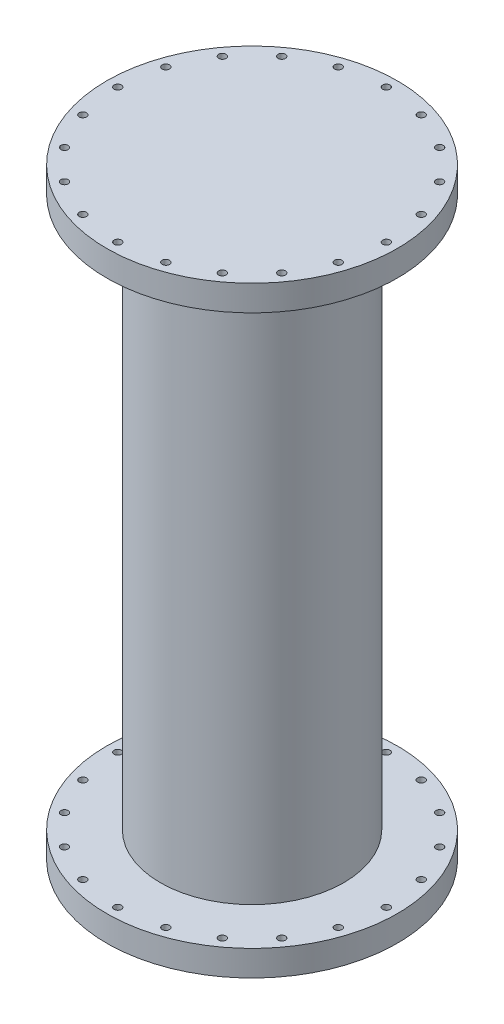
from build123d import *

# Parameters (mm, degrees)
ESQUISSE2_R                  = 10
ENL_V_MAT_EXTRU_1_DEPTH      = 1733.983554452
R_P_TITION_CIRCULAIRE1_COUNT = 20


with BuildPart() as part:
    # Esquisse1 → Révolution1 (revolve)
    with BuildSketch(Plane.XY, mode=Mode.PRIVATE) as r_volution1_sk:
        Polygon((0, 0), (396, 0), (396, -70), (250, -70), (250, -1570), (396, -1570), (396, -1640), (0, -1640), (0, -1570), (200, -1570), (200, -70), (0, -70), align=None)
    revolve(r_volution1_sk.sketch.rotate(Axis((0, 0, 0), (0, -1, 0)), 180), axis=Axis((0, 0, 0), (0, -1, 0)))

    # Esquisse2 → Enlèv. mat.-Extru.1 (cut, through all)
    with BuildSketch(Plane(origin=(0, 0, 0), x_dir=(1, 0, 0), z_dir=(0, 1, 0))):
        with Locations(Location((366, 0, 0), (0, 0, 180))):
            Circle(ESQUISSE2_R)
    enl_v_mat_extru_1 = extrude(amount=-ENL_V_MAT_EXTRU_1_DEPTH, mode=Mode.SUBTRACT)

    # Répétition circulaire1: Enlèv. mat.-Extru.1 ×20 about axis
    r_p_tition_circulaire1_axis = Axis((0, 0, 0), (0, 1, 0))
    for i in range(1, R_P_TITION_CIRCULAIRE1_COUNT):
        add(enl_v_mat_extru_1.rotate(r_p_tition_circulaire1_axis, i * 360 / R_P_TITION_CIRCULAIRE1_COUNT), mode=Mode.SUBTRACT)


solid = part.part
